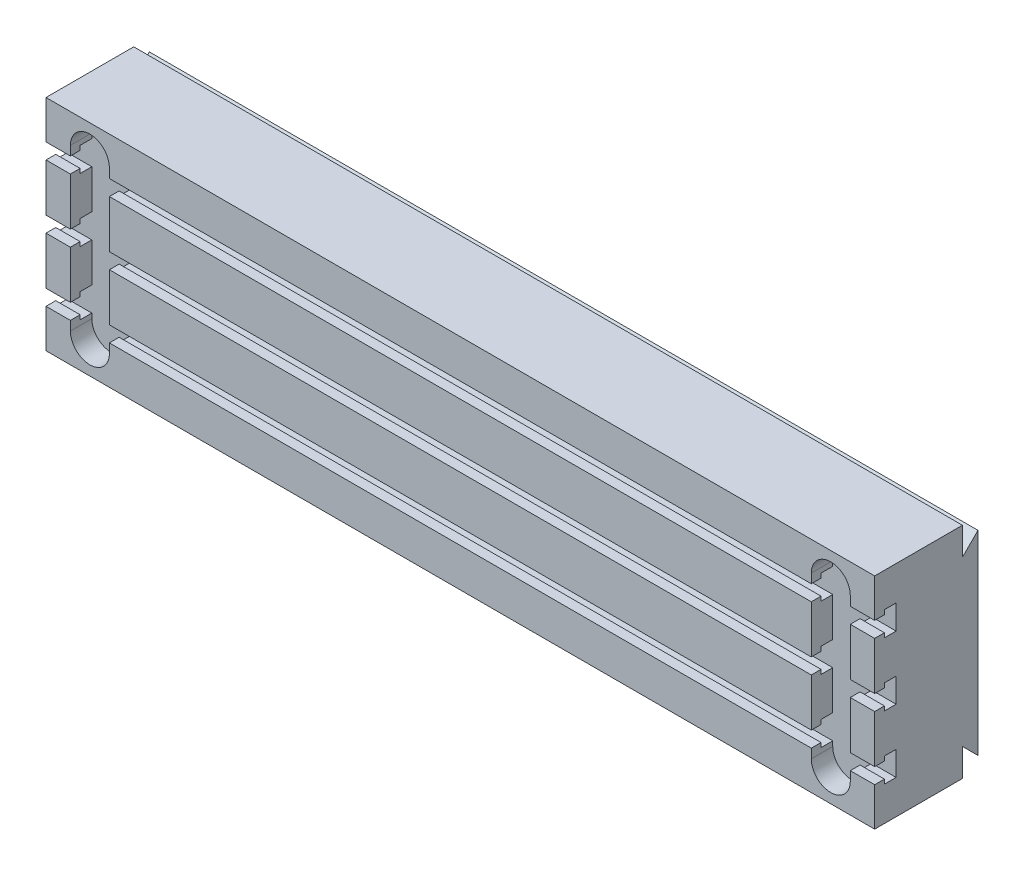
from build123d import *

# Parameters (mm, degrees)
SKETCH1_W                      = 225
SKETCH1_H                      = 90
BOSS_EXTRUDE1_DEPTH            = 425
CUT_EXTRUDE1_DEPTH             = 444.849355074
LPATTERN1_COUNT                = 2
LPATTERN1_PITCH                = 65
LPATTERN1_COL_COUNT            = 2
LPATTERN1_COL_PITCH            = 65
CUT_EXTRUDE2_REACH             = 454.236
CUT_EXTRUDE2_DIRECTION_2_DEPTH = 453.235834493


with BuildPart() as part:
    # Sketch1 → Boss-Extrude1 (new, symmetric)
    with BuildSketch(Plane.YZ):
        Polygon((100, -61), (84, -45), (-84, -45), (-100, -61), align=None)
        Rectangle(SKETCH1_W, SKETCH1_H)
    extrude(amount=BOSS_EXTRUDE1_DEPTH, both=True)

    # Sketch2 → Cut-Extrude1 (cut, symmetric)
    with BuildSketch(Plane.YZ):
        Polygon((-8, 45), (-8, 35), (-12.5, 35), (-12.5, 23), (12.5, 23), (12.5, 35), (8, 35), (8, 45), align=None)
    cut_extrude1 = extrude(amount=CUT_EXTRUDE1_DEPTH, both=True, mode=Mode.SUBTRACT)

    # LPattern1: Cut-Extrude1 ×2
    with Locations(*[(0, i * LPATTERN1_PITCH, 0) for i in range(1, LPATTERN1_COUNT)]):
        add(cut_extrude1, mode=Mode.SUBTRACT)

    # LPattern1 col: Cut-Extrude1 ×2
    with Locations(*[(0, -i * LPATTERN1_COL_PITCH, 0) for i in range(1, LPATTERN1_COL_COUNT)]):
        add(cut_extrude1, mode=Mode.SUBTRACT)

    # Cut-Extrude2: up to this face of the body (flat: up to its plane)
    cut_extrude2_end = Plane(part.part.faces().sort_by_distance((0, 0, 23))[0])
    # Sketch3 → Cut-Extrude2 (cut, up to the picked face)
    with BuildSketch(Plane.XY.offset(45), mode=Mode.PRIVATE) as cut_extrude2_sk1:
        with BuildLine():
            Line((400, 82.5), (400, -82.5))
            ThreePointArc((400, -82.5), (380, -102.5), (360, -82.5))
            Line((360, -82.5), (360, 82.5))
            ThreePointArc((360, 82.5), (380, 102.5), (400, 82.5))
        make_face()
    cut_extrude2_tool1 = split(extrude(cut_extrude2_sk1.sketch, amount=-CUT_EXTRUDE2_REACH, mode=Mode.PRIVATE), bisect_by=cut_extrude2_end, keep=Keep.BOTH, mode=Mode.PRIVATE)
    # Sketch3 → Cut-Extrude2 (cut, up to the picked face)
    with BuildSketch(Plane.XY.offset(45), mode=Mode.PRIVATE) as cut_extrude2_sk2:
        with BuildLine():
            Line((-400, 82.5), (-400, -82.5))
            ThreePointArc((-400, -82.5), (-380, -102.5), (-360, -82.5))
            Line((-360, -82.5), (-360, 82.5))
            ThreePointArc((-360, 82.5), (-380, 102.5), (-400, 82.5))
        make_face()
    cut_extrude2_tool2 = split(extrude(cut_extrude2_sk2.sketch, amount=-CUT_EXTRUDE2_REACH, mode=Mode.PRIVATE), bisect_by=cut_extrude2_end, keep=Keep.BOTH, mode=Mode.PRIVATE)
    add(cut_extrude2_tool1.solids().sort_by(Axis((380, 0, 45), (0, 0, -1)))[0], mode=Mode.SUBTRACT)
    add(cut_extrude2_tool2.solids().sort_by(Axis((-380, 0, 45), (0, 0, -1)))[0], mode=Mode.SUBTRACT)

    # Sketch3 → Cut-Extrude2 direction 2 (cut)
    with BuildSketch(Plane.XY.offset(45)):
        with BuildLine():
            Line((400, 82.5), (400, -82.5))
            ThreePointArc((400, -82.5), (380, -102.5), (360, -82.5))
            Line((360, -82.5), (360, 82.5))
            ThreePointArc((360, 82.5), (380, 102.5), (400, 82.5))
        make_face()
        with BuildLine():
            Line((-400, 82.5), (-400, -82.5))
            ThreePointArc((-400, -82.5), (-380, -102.5), (-360, -82.5))
            Line((-360, -82.5), (-360, 82.5))
            ThreePointArc((-360, 82.5), (-380, 102.5), (-400, 82.5))
        make_face()
    extrude(amount=CUT_EXTRUDE2_DIRECTION_2_DEPTH, mode=Mode.SUBTRACT)


solid = part.part
